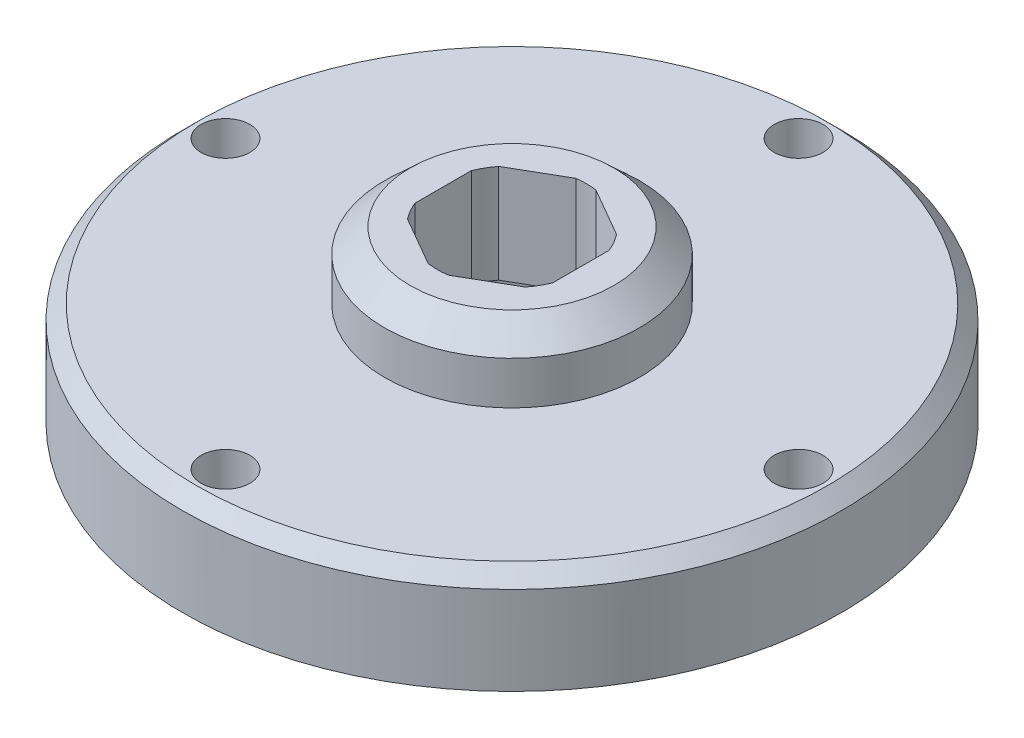
from build123d import *

# Parameters (mm, degrees)
M3_CLEARANCE_HOLE1_D = 3.4
CIRPATTERN1_COUNT    = 4
BOSS_EXTRUDE1_START  = -6.876
BOSS_EXTRUDE1_DEPTH  = 6.876
CHAMFER1_SIZE        = 0.75
CHAMFER2_SIZE        = 1


with BuildPart() as part:
    # Sketch1 → Revolve1 (revolve)
    with BuildSketch(Plane.XY, mode=Mode.PRIVATE) as revolve1_sk:
        Polygon((6.8, 0), (6.8, 4.953), (5.2, 4.953), (5.2, 11.829), (7.112, 11.829), (8.9, 10.1665), (8.9, 7.1665), (23, 7.1665), (23, 0), align=None)
    revolve(revolve1_sk.sketch.rotate(Axis((0, 0, 0), (0, 1, 0)), 90), axis=Axis((0, 0, 0), (0, 1, 0)))

    # M3 Clearance Hole1 (through all)
    with Locations(Plane.XZ):
        with Locations((-20, 0)):
            m3_clearance_hole1 = Hole(M3_CLEARANCE_HOLE1_D / 2)

    # CirPattern1: M3 Clearance Hole1 ×4 about axis
    cirpattern1_axis = Axis((0, 0, 0), (0, 1, 0))
    for i in range(1, CIRPATTERN1_COUNT):
        add(m3_clearance_hole1.rotate(cirpattern1_axis, i * 360 / CIRPATTERN1_COUNT), mode=Mode.SUBTRACT)

    # Sketch4 → Boss-Extrude1 (add)
    with BuildSketch(Plane.XZ.offset(-4.953).offset(BOSS_EXTRUDE1_START)):
        with BuildLine():
            Line((0.700412138, 5.152613205), (4.112087862, 3.182881307))
            ThreePointArc((4.112087862, 3.182881307), (2.6, 4.5033321), (0.700412138, 5.152613205))
        make_face()
        with BuildLine():
            ThreePointArc((4.8125, -1.969731898), (5.2, 0), (4.8125, 1.969731898))
            Line((4.8125, 1.969731898), (4.8125, -1.969731898))
        make_face()
        with BuildLine():
            Line((-4.112087862, 3.182881307), (-0.700412138, 5.152613205))
            ThreePointArc((-0.700412138, 5.152613205), (-2.6, 4.5033321), (-4.112087862, 3.182881307))
        make_face()
        with BuildLine():
            ThreePointArc((0.700412138, -5.152613205), (2.6, -4.5033321), (4.112087862, -3.182881307))
            Line((4.112087862, -3.182881307), (0.700412138, -5.152613205))
        make_face()
        with BuildLine():
            Line((-4.8125, -1.969731898), (-4.8125, 1.969731898))
            ThreePointArc((-4.8125, 1.969731898), (-5.2, 0), (-4.8125, -1.969731898))
        make_face()
        with BuildLine():
            ThreePointArc((-4.112087862, -3.182881307), (-2.6, -4.5033321), (-0.700412138, -5.152613205))
            Line((-0.700412138, -5.152613205), (-4.112087862, -3.182881307))
        make_face()
    extrude(amount=BOSS_EXTRUDE1_DEPTH)

    # Chamfer1
    chamfer1_edges = [part.edges().sort_by_distance(p)[0] for p in [
        (0, 0, 6.8),
    ]]
    chamfer(chamfer1_edges, length=CHAMFER1_SIZE)

    # Chamfer2
    chamfer2_edges = [part.edges().sort_by_distance(p)[0] for p in [
        (0, 7.1665, 23),
    ]]
    chamfer(chamfer2_edges, length=CHAMFER2_SIZE)


solid = part.part
